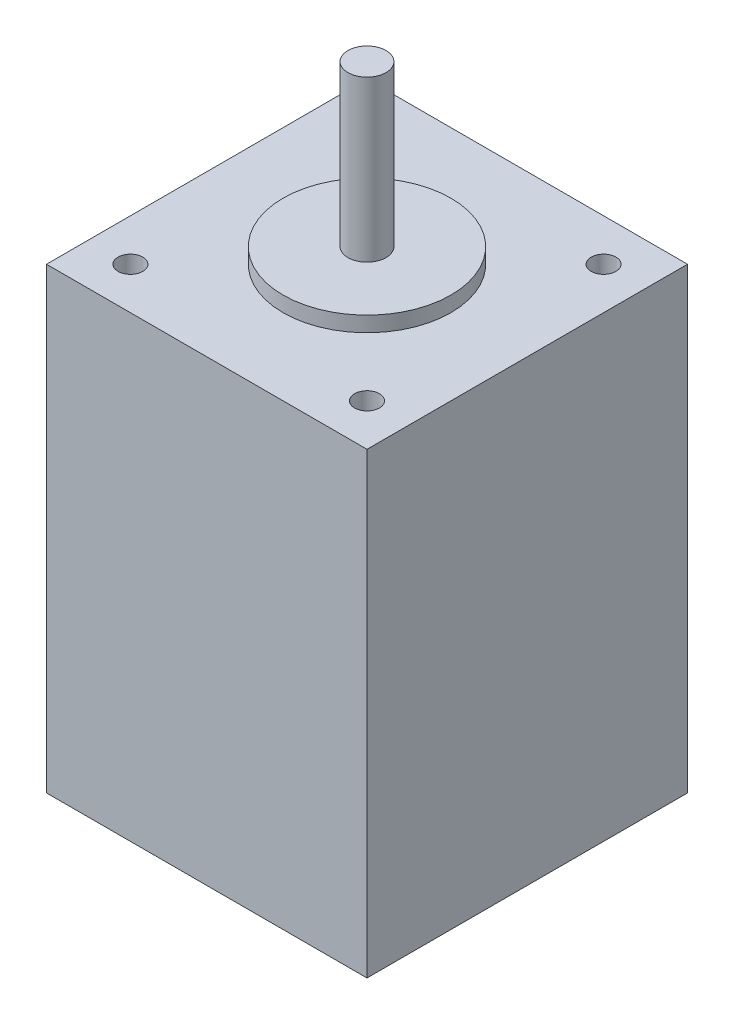
from build123d import *

# Parameters (mm, degrees)
SKETCH_1_W          = 42
SKETCH_1_H          = 42
EXTRUDE_1_DEPTH     = 60
SKETCH_2_R          = 11
EXTRUDE_2_DEPTH     = 2
SKETCH_3_R          = 2.5
EXTRUDE_3_DEPTH     = 21
SKETCH_4_R          = 1.625
CUT_EXTRUDE_1_DEPTH = 85.427483677


with BuildPart() as part:
    # 草图1 → 凸台-拉伸1 (new body)
    with BuildSketch(Plane(origin=(0, 0, 0), x_dir=(1, 0, 0), z_dir=(0, 1, 0))):
        with Locations((21, 21)):
            Rectangle(SKETCH_1_W, SKETCH_1_H)
    extrude(amount=EXTRUDE_1_DEPTH)

    # 草图2 → 凸台-拉伸2 (add)
    with BuildSketch(Plane(origin=(0, 60, 0), x_dir=(1, 0, 0), z_dir=(0, 1, 0))):
        with Locations(Location((21, 21, 0), (0, 0, 270))):
            Circle(SKETCH_2_R)
    extrude(amount=EXTRUDE_2_DEPTH)

    # 草图3 → 凸台-拉伸3 (add)
    with BuildSketch(Plane(origin=(0, 62, 0), x_dir=(1, 0, 0), z_dir=(0, 1, 0))):
        with Locations(Location((21, 21, 0), (0, 0, 90))):
            Circle(SKETCH_3_R)
    extrude(amount=EXTRUDE_3_DEPTH)

    # 草图4 → 切除-拉伸1 (cut, through all)
    with BuildSketch(Plane(origin=(0, 60, 0), x_dir=(1, 0, 0), z_dir=(0, 1, 0))):
        with Locations(Location((5.5, 36.5, 0), (0, 0, 270))):
            Circle(SKETCH_4_R)
        with Locations(Location((36.5, 36.5, 0), (0, 0, 270))):
            Circle(SKETCH_4_R)
        with Locations(Location((36.5, 5.5, 0), (0, 0, 270))):
            Circle(SKETCH_4_R)
        with Locations(Location((5.5, 5.5, 0), (0, 0, 270))):
            Circle(SKETCH_4_R)
    extrude(amount=-CUT_EXTRUDE_1_DEPTH, mode=Mode.SUBTRACT)


solid = part.part
